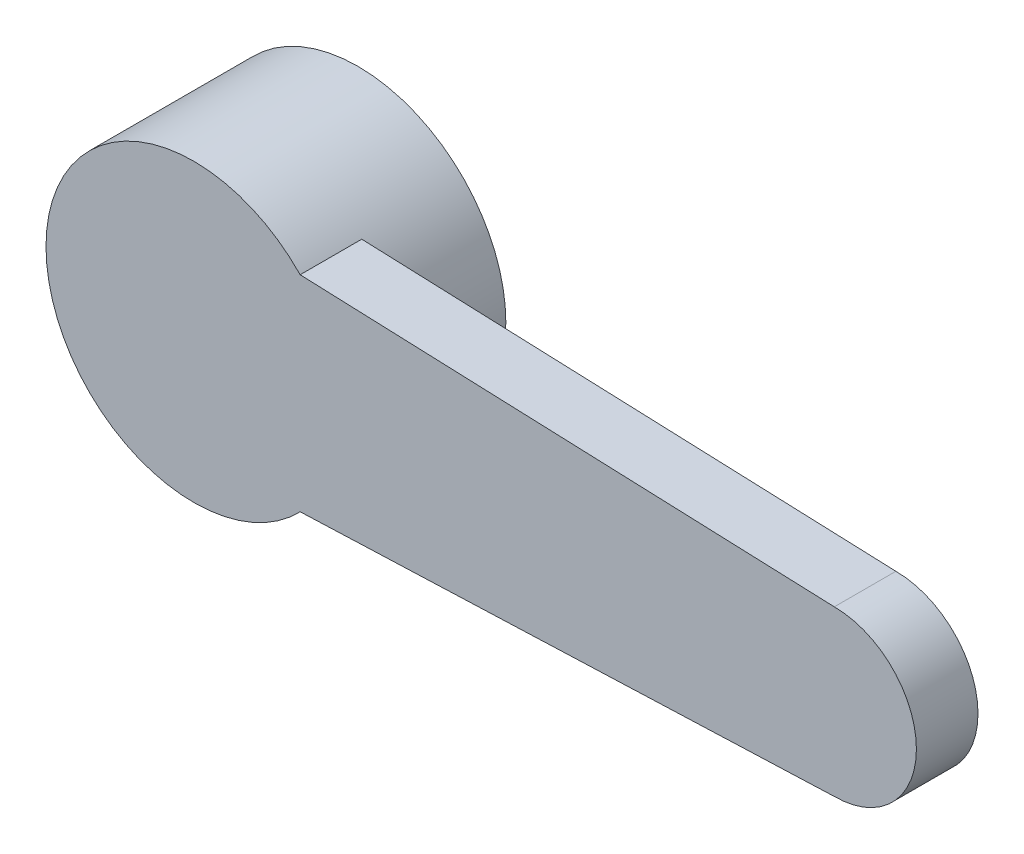
from build123d import *

# Parameters (mm, degrees)
SKETCH_1_R      = 3.6
EXTRUDE_1_DEPTH = 4
EXTRUDE_2_DEPTH = 1.5


with BuildPart() as part:
    # 草图1 → 凸台-拉伸1 (new body)
    with BuildSketch(Plane.XY):
        Circle(SKETCH_1_R)
    extrude(amount=EXTRUDE_1_DEPTH)

    # 草图2 → 凸台-拉伸2 (add)
    with BuildSketch(Plane.XY.offset(4)):
        with BuildLine():
            Line((2.590366769, 2.5), (15.6, 2))
            ThreePointArc((15.6, 2), (17.6, 0), (15.6, -2))
            Line((15.6, -2), (2.590366769, -2.5))
            Line((2.590366769, -2.5), (2.590366769, 2.5))
        make_face()
    extrude(amount=-EXTRUDE_2_DEPTH)


solid = part.part
